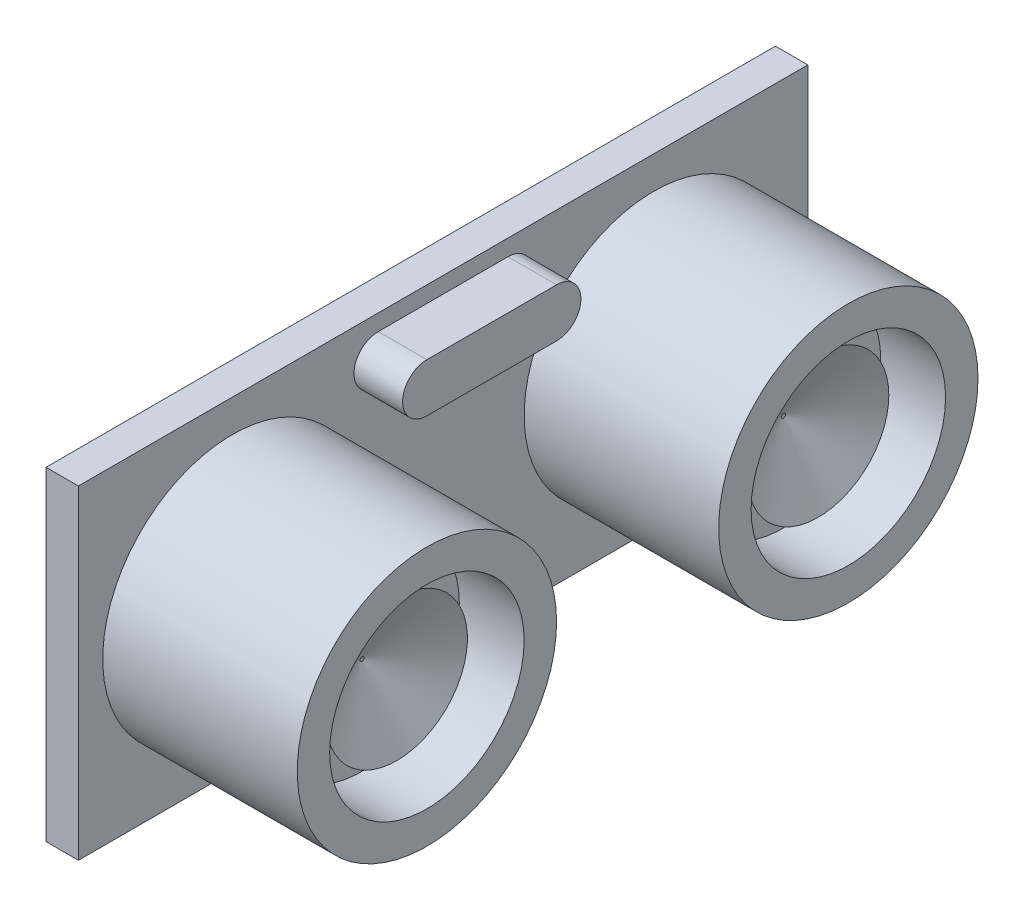
from build123d import *

# Parameters (mm, degrees)
SKETCH_1_W          = 45
SKETCH_1_H          = 20
EXTRUDE_1_DEPTH     = 2
EXTRUDE_2_DEPTH     = 3
SKETCH_3_R          = 8
EXTRUDE_3_DEPTH     = 12
SKETCH_4_R          = 6
CUT_EXTRUDE_1_DEPTH = 4


with BuildPart() as part:
    # 草图1 → 凸台-拉伸1 (new body)
    with BuildSketch(Plane(origin=(0, 0, 0), x_dir=(0, 0, -1), z_dir=(1, 0, 0))):
        Rectangle(SKETCH_1_W, SKETCH_1_H)
    extrude(amount=EXTRUDE_1_DEPTH)

    # 草图2 → 凸台-拉伸2 (add)
    with BuildSketch(Plane(origin=(2, 0, 0), x_dir=(0, 0, -1), z_dir=(1, 0, 0))):
        with BuildLine():
            Line((-4, 9), (4, 9))
            ThreePointArc((4, 9), (5.5, 7.5), (4, 6))
            Line((4, 6), (-4, 6))
            ThreePointArc((-4, 6), (-5.5, 7.5), (-4, 9))
        make_face()
    extrude(amount=EXTRUDE_2_DEPTH)

    # 草图3 → 凸台-拉伸3 (add)
    with BuildSketch(Plane(origin=(2, 0, 0), x_dir=(0, 0, -1), z_dir=(1, 0, 0))):
        with Locations((-13, 0)):
            Circle(SKETCH_3_R)
        with Locations((13, 0)):
            Circle(SKETCH_3_R)
    extrude(amount=EXTRUDE_3_DEPTH)

    # 草图4 → 切除-拉伸1 (cut)
    with BuildSketch(Plane(origin=(14, 0, 0), x_dir=(0, 0, -1), z_dir=(1, 0, 0))):
        with Locations((-13, 0)):
            Circle(SKETCH_4_R)
        with Locations((13, 0)):
            Circle(SKETCH_4_R)
    extrude(amount=-CUT_EXTRUDE_1_DEPTH, mode=Mode.SUBTRACT)


with BuildPart() as body_2:
    # 草图5 → 旋转2 (revolve)
    with BuildSketch(Plane(origin=(0, 0, 0), x_dir=(1, 0, 0), z_dir=(0, 1, 0))):
        with BuildLine():
            Line((10, 13.123728158), (12.143734127, 17.35374243))
            add(Edge.make_bspline(
                [(12.143734127, 17.35374243), (9.980962456, 15.851185467), (10, 13.123728158)],
                knots=[0, 0, 0, 1, 1, 1], degree=2))
        make_face()
    revolve_2 = revolve(axis=Axis((10, 0, -13), (1, 0, 0)))


with BuildPart() as part_1:
    add(part.part)

    # 镜向9: 旋转2 across plane
    add(revolve_2.mirror(Plane.XY))


solid = Compound([body_2.part, part_1.part])
